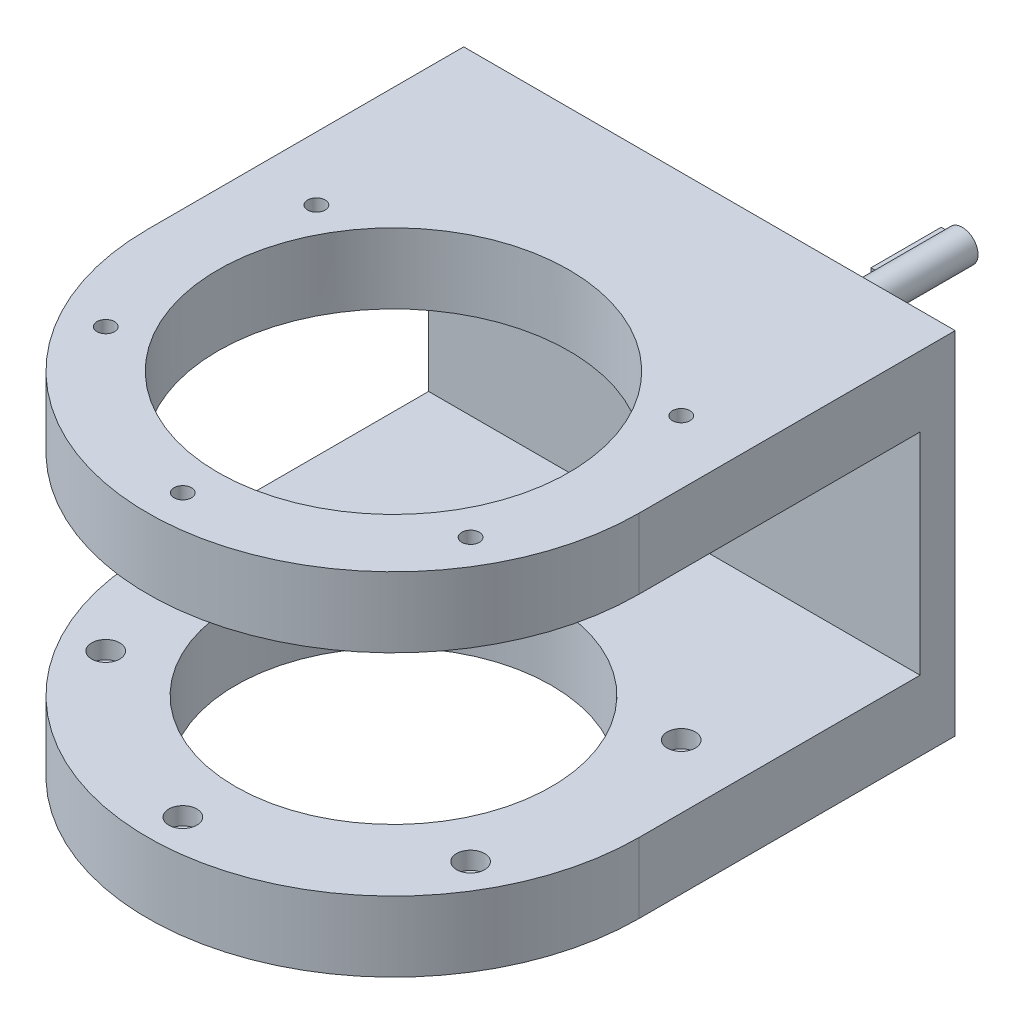
from build123d import *
from build123d.topology import SkipClean

# Parameters (mm, degrees)
SKETCH_1_R           = 25
EXTRUDE_1_DEPTH      = 22
SKETCH_2_W           = 140
SKETCH_2_H           = 100
EXTRUDE_2_DEPTH      = 10
SKETCH_4_W           = 140
SKETCH_4_H           = 20
EXTRUDE_3_DEPTH      = 150
CUT_EXTRUDE_1_DEPTH  = 150
CUT_EXTRUDE_3_REACH  = 221.144
SKETCH_8_R           = 50
CUT_EXTRUDE_4_REACH  = 221.144
SKETCH_9_R           = 45
SKETCH_7_R           = 4.5
EXTRUDE_4_DEPTH      = 50
CUT_EXTRUDE_5_REACH  = 221.144
SKETCH_10_R          = 2.5
CUT_EXTRUDE_START    = -5
SKETCH_11_R          = 4
SKETCH_11_R_2        = 2.5
CUT_EXTRUDE_7_DEPTH  = 5
CUT_EXTRUDE_9_REACH  = 221.144
SKETCH_13_R          = 2.5
SKETCH_14_R          = 4
CUT_EXTRUDE_11_DEPTH = 5
SKETCH_16_W          = 6
SKETCH_16_H          = 3
EXTRUDE_5_DEPTH      = 50
CUT_EXTRUDE_12_DEPTH = 30


with BuildPart() as part:
    # 草图1 → 凸台-拉伸1 (new body)
    with BuildSketch(Plane.XY):
        with Locations((0, -0.593277016)):
            Circle(SKETCH_1_R)
    extrude(amount=EXTRUDE_1_DEPTH)

    # 草图2 → 凸台-拉伸2 (add)
    with BuildSketch(Plane.XY.offset(22)):
        Rectangle(SKETCH_2_W, SKETCH_2_H)
    extrude(amount=EXTRUDE_2_DEPTH)

    # 草图4 → 凸台-拉伸3 (add)
    with BuildSketch(Plane.XY.offset(32)):
        with Locations((0, 40)):
            Rectangle(SKETCH_4_W, SKETCH_4_H)
        with Locations((0, -40)):
            Rectangle(SKETCH_4_W, SKETCH_4_H)
    extrude(amount=EXTRUDE_3_DEPTH)

    # 草图6 → 切除-拉伸1 (cut)
    with BuildSketch(Plane(origin=(0, 50, 0), x_dir=(1, 0, 0), z_dir=(0, 1, 0))):
        with BuildLine():
            ThreePointArc((0, -182), (-49.497474683, -161.497474683), (-70, -112))
            Line((-70, -112), (-70, -182))
            Line((-70, -182), (0, -182))
        make_face()
        with BuildLine():
            Line((70, -182), (70, -112))
            ThreePointArc((70, -112), (49.497474683, -161.497474683), (0, -182))
            Line((0, -182), (70, -182))
        make_face()
    extrude(amount=-CUT_EXTRUDE_1_DEPTH, mode=Mode.SUBTRACT)

    # 草图8 → 切除-拉伸3 (cut, up to next)
    with BuildSketch(Plane(origin=(0, 50, 0), x_dir=(1, 0, 0), z_dir=(0, 1, 0)), mode=Mode.PRIVATE) as cut_extrude_3_sk1:
        with Locations(Location((0, -112, 0), (0, 0, 270))):
            Circle(SKETCH_8_R)
    cut_extrude_3_tool1 = extrude(cut_extrude_3_sk1.sketch, amount=-CUT_EXTRUDE_3_REACH, mode=Mode.PRIVATE) & part.part
    add(cut_extrude_3_tool1.solids().sort_by_distance((0, 50, 112))[0], mode=Mode.SUBTRACT)

    # 草图9 → 切除-拉伸4 (cut, up to next)
    with BuildSketch(Plane.XZ.offset(50), mode=Mode.PRIVATE) as cut_extrude_4_sk1:
        with Locations(Location((0, 112, 0), (0, 0, 270))):
            Circle(SKETCH_9_R)
    cut_extrude_4_tool1 = extrude(cut_extrude_4_sk1.sketch, amount=-CUT_EXTRUDE_4_REACH, mode=Mode.PRIVATE) & part.part
    add(cut_extrude_4_tool1.solids().sort_by_distance((0, -50, 112))[0], mode=Mode.SUBTRACT)

    # 草图7 → 凸台-拉伸4 (add)
    with BuildSketch(Plane(origin=(0, 0, 0), x_dir=(-1, 0, 0), z_dir=(0, 0, -1))):
        Circle(SKETCH_7_R)
    extrude(amount=EXTRUDE_4_DEPTH)

    # 草图10 → 切除-拉伸5 (cut, up to next)
    with BuildSketch(Plane.XZ.offset(50), mode=Mode.PRIVATE) as cut_extrude_5_sk1:
        with Locations(Location((0, 172, 0), (0, 0, 270))):
            Circle(SKETCH_10_R)
    cut_extrude_5_tool1 = extrude(cut_extrude_5_sk1.sketch, amount=-CUT_EXTRUDE_5_REACH, mode=Mode.PRIVATE) & part.part
    # 草图10 → 切除-拉伸5 (cut, up to next)
    with BuildSketch(Plane.XZ.offset(50), mode=Mode.PRIVATE) as cut_extrude_5_sk2:
        with Locations(Location((51.961524227, 142, 0), (0, 0, 270))):
            Circle(SKETCH_10_R)
    cut_extrude_5_tool2 = extrude(cut_extrude_5_sk2.sketch, amount=-CUT_EXTRUDE_5_REACH, mode=Mode.PRIVATE) & part.part
    # 草图10 → 切除-拉伸5 (cut, up to next)
    with BuildSketch(Plane.XZ.offset(50), mode=Mode.PRIVATE) as cut_extrude_5_sk3:
        with Locations(Location((51.961524227, 82, 0), (0, 0, 270))):
            Circle(SKETCH_10_R)
    cut_extrude_5_tool3 = extrude(cut_extrude_5_sk3.sketch, amount=-CUT_EXTRUDE_5_REACH, mode=Mode.PRIVATE) & part.part
    # 草图10 → 切除-拉伸5 (cut, up to next)
    with BuildSketch(Plane.XZ.offset(50), mode=Mode.PRIVATE) as cut_extrude_5_sk4:
        with Locations(Location((0, 52, 0), (0, 0, 270))):
            Circle(SKETCH_10_R)
    cut_extrude_5_tool4 = extrude(cut_extrude_5_sk4.sketch, amount=-CUT_EXTRUDE_5_REACH, mode=Mode.PRIVATE) & part.part
    # 草图10 → 切除-拉伸5 (cut, up to next)
    with BuildSketch(Plane.XZ.offset(50), mode=Mode.PRIVATE) as cut_extrude_5_sk5:
        with Locations(Location((-51.961524227, 82, 0), (0, 0, 270))):
            Circle(SKETCH_10_R)
    cut_extrude_5_tool5 = extrude(cut_extrude_5_sk5.sketch, amount=-CUT_EXTRUDE_5_REACH, mode=Mode.PRIVATE) & part.part
    # 草图10 → 切除-拉伸5 (cut, up to next)
    with BuildSketch(Plane.XZ.offset(50), mode=Mode.PRIVATE) as cut_extrude_5_sk6:
        with Locations(Location((-51.961524227, 142, 0), (0, 0, 270))):
            Circle(SKETCH_10_R)
    cut_extrude_5_tool6 = extrude(cut_extrude_5_sk6.sketch, amount=-CUT_EXTRUDE_5_REACH, mode=Mode.PRIVATE) & part.part
    add(cut_extrude_5_tool1.solids().sort_by_distance((0, -50, 172))[0], mode=Mode.SUBTRACT)
    add(cut_extrude_5_tool2.solids().sort_by_distance((51.961524, -50, 142))[0], mode=Mode.SUBTRACT)
    add(cut_extrude_5_tool3.solids().sort_by_distance((51.961524, -50, 82))[0], mode=Mode.SUBTRACT)
    add(cut_extrude_5_tool4.solids().sort_by_distance((0, -50, 52))[0], mode=Mode.SUBTRACT)
    add(cut_extrude_5_tool5.solids().sort_by_distance((-51.961524, -50, 82))[0], mode=Mode.SUBTRACT)
    add(cut_extrude_5_tool6.solids().sort_by_distance((-51.961524, -50, 142))[0], mode=Mode.SUBTRACT)

    # 草图11 → 切除-拉伸7 (cut)
    # profile 1 of 6: a face of its own
    with BuildSketch(Plane(origin=(0, -30, 0), x_dir=(1, 0, 0), z_dir=(0, 1, 0)).offset(CUT_EXTRUDE_START)):
        with Locations(Location((0, -52, 0), (0, 0, 270))):
            Circle(SKETCH_11_R)
        with Locations(Location((0, -52, 0), (0, 0, 90))):
            Circle(SKETCH_11_R_2, mode=Mode.SUBTRACT)
    # profile 2 of 6: a face of its own
    with BuildSketch(Plane(origin=(0, -30, 0), x_dir=(1, 0, 0), z_dir=(0, 1, 0)).offset(CUT_EXTRUDE_START)):
        with Locations(Location((51.961524227, -82, 0), (0, 0, 270))):
            Circle(SKETCH_11_R)
    # profile 3 of 6: a face of its own
    with BuildSketch(Plane(origin=(0, -30, 0), x_dir=(1, 0, 0), z_dir=(0, 1, 0)).offset(CUT_EXTRUDE_START)):
        with Locations(Location((-51.961524227, -82, 0), (0, 0, 270))):
            Circle(SKETCH_11_R)
    # profile 4 of 6: a face of its own
    with BuildSketch(Plane(origin=(0, -30, 0), x_dir=(1, 0, 0), z_dir=(0, 1, 0)).offset(CUT_EXTRUDE_START)):
        with Locations(Location((-51.961524227, -142, 0), (0, 0, 270))):
            Circle(SKETCH_11_R)
    # profile 5 of 6: a face of its own
    with BuildSketch(Plane(origin=(0, -30, 0), x_dir=(1, 0, 0), z_dir=(0, 1, 0)).offset(CUT_EXTRUDE_START)):
        with Locations(Location((0, -172, 0), (0, 0, 270))):
            Circle(SKETCH_11_R)
    # profile 6 of 6: a face of its own
    with BuildSketch(Plane(origin=(0, -30, 0), x_dir=(1, 0, 0), z_dir=(0, 1, 0)).offset(CUT_EXTRUDE_START)):
        with Locations(Location((51.961524227, -142, 0), (0, 0, 270))):
            Circle(SKETCH_11_R)
    extrude(amount=CUT_EXTRUDE_7_DEPTH, mode=Mode.SUBTRACT)

    # 草图13 → 切除-拉伸9 (cut, up to next)
    with BuildSketch(Plane(origin=(0, 50, 0), x_dir=(1, 0, 0), z_dir=(0, 1, 0)), mode=Mode.PRIVATE) as cut_extrude_9_sk1:
        with Locations(Location((51.961524227, -82, 0), (0, 0, 90))):
            Circle(SKETCH_13_R)
    cut_extrude_9_tool1 = extrude(cut_extrude_9_sk1.sketch, amount=-CUT_EXTRUDE_9_REACH, mode=Mode.PRIVATE) & part.part
    # 草图13 → 切除-拉伸9 (cut, up to next)
    with BuildSketch(Plane(origin=(0, 50, 0), x_dir=(1, 0, 0), z_dir=(0, 1, 0)), mode=Mode.PRIVATE) as cut_extrude_9_sk2:
        with Locations(Location((51.961524227, -142, 0), (0, 0, 90))):
            Circle(SKETCH_13_R)
    cut_extrude_9_tool2 = extrude(cut_extrude_9_sk2.sketch, amount=-CUT_EXTRUDE_9_REACH, mode=Mode.PRIVATE) & part.part
    # 草图13 → 切除-拉伸9 (cut, up to next)
    with BuildSketch(Plane(origin=(0, 50, 0), x_dir=(1, 0, 0), z_dir=(0, 1, 0)), mode=Mode.PRIVATE) as cut_extrude_9_sk3:
        with Locations(Location((0, -172, 0), (0, 0, 90))):
            Circle(SKETCH_13_R)
    cut_extrude_9_tool3 = extrude(cut_extrude_9_sk3.sketch, amount=-CUT_EXTRUDE_9_REACH, mode=Mode.PRIVATE) & part.part
    # 草图13 → 切除-拉伸9 (cut, up to next)
    with BuildSketch(Plane(origin=(0, 50, 0), x_dir=(1, 0, 0), z_dir=(0, 1, 0)), mode=Mode.PRIVATE) as cut_extrude_9_sk4:
        with Locations(Location((-51.961524227, -142, 0), (0, 0, 90))):
            Circle(SKETCH_13_R)
    cut_extrude_9_tool4 = extrude(cut_extrude_9_sk4.sketch, amount=-CUT_EXTRUDE_9_REACH, mode=Mode.PRIVATE) & part.part
    # 草图13 → 切除-拉伸9 (cut, up to next)
    with BuildSketch(Plane(origin=(0, 50, 0), x_dir=(1, 0, 0), z_dir=(0, 1, 0)), mode=Mode.PRIVATE) as cut_extrude_9_sk5:
        with Locations(Location((-51.961524227, -82, 0), (0, 0, 90))):
            Circle(SKETCH_13_R)
    cut_extrude_9_tool5 = extrude(cut_extrude_9_sk5.sketch, amount=-CUT_EXTRUDE_9_REACH, mode=Mode.PRIVATE) & part.part
    add(cut_extrude_9_tool1.solids().sort_by_distance((51.961524, 50, 82))[0], mode=Mode.SUBTRACT)
    add(cut_extrude_9_tool2.solids().sort_by_distance((51.961524, 50, 142))[0], mode=Mode.SUBTRACT)
    add(cut_extrude_9_tool3.solids().sort_by_distance((0, 50, 172))[0], mode=Mode.SUBTRACT)
    add(cut_extrude_9_tool4.solids().sort_by_distance((-51.961524, 50, 142))[0], mode=Mode.SUBTRACT)
    add(cut_extrude_9_tool5.solids().sort_by_distance((-51.961524, 50, 82))[0], mode=Mode.SUBTRACT)

    # 草图14 → 切除-拉伸11 (cut)
    with BuildSketch(Plane.XZ.offset(-30)):
        with Locations(Location((0, 172, 0), (0, 0, 90))):
            Circle(SKETCH_14_R)
        with Locations(Location((-51.961524227, 142, 0), (0, 0, 90))):
            Circle(SKETCH_14_R)
        with Locations(Location((-51.961524227, 82, 0), (0, 0, 90))):
            Circle(SKETCH_14_R)
        with Locations(Location((0, 52, 0), (0, 0, 90))):
            Circle(SKETCH_14_R)
        with Locations(Location((51.961524227, 82, 0), (0, 0, 90))):
            Circle(SKETCH_14_R)
        with Locations(Location((51.961524227, 142, 0), (0, 0, 90))):
            Circle(SKETCH_14_R)
    extrude(amount=-CUT_EXTRUDE_11_DEPTH, mode=Mode.SUBTRACT)

    # 草图16 → 凸台-拉伸5 (add)
    with BuildSketch(Plane(origin=(0, 0, 0), x_dir=(-1, 0, 0), z_dir=(0, 0, -1))):
        with Locations((3, 0)):
            Rectangle(SKETCH_16_W, SKETCH_16_H)
    extrude(amount=EXTRUDE_5_DEPTH)

    # 草图17 → 切除-拉伸12 (cut)
    with SkipClean():  # the faces are left unmerged after this step: merging them gives an invalid solid
        with BuildSketch(Plane(origin=(0, 0, 0), x_dir=(-1, 0, 0), z_dir=(0, 0, -1))):
            with BuildLine():
                Line((6, -1.5), (6, 1.5))
                Line((6, 1.5), (4.242640687, 1.5))
                ThreePointArc((4.242640687, 1.5), (4.435193518, 0.760958904), (4.5, 0))
                ThreePointArc((4.5, 0), (4.435193518, -0.760958904), (4.242640687, -1.5))
                Line((4.242640687, -1.5), (6, -1.5))
            make_face()
        extrude(amount=CUT_EXTRUDE_12_DEPTH, mode=Mode.SUBTRACT)


solid = part.part
